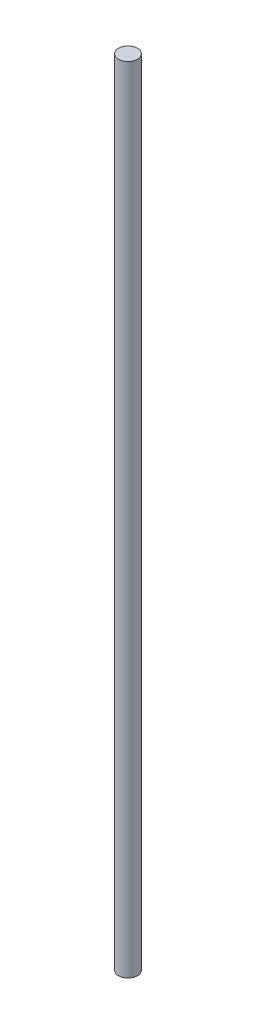
from build123d import *

# Parameters (mm, degrees)
SKETCH2_R           = 3
BOSS_EXTRUDE1_DEPTH = 250


with BuildPart() as part:
    # Sketch2 → Boss-Extrude1 (new body)
    with BuildSketch(Plane(origin=(0, 0, 0), x_dir=(1, 0, 0), z_dir=(0, 1, 0))):
        with Locations(Location((0, 0, 0), (0, 0, 270))):
            Circle(SKETCH2_R)
    extrude(amount=BOSS_EXTRUDE1_DEPTH)


solid = part.part
